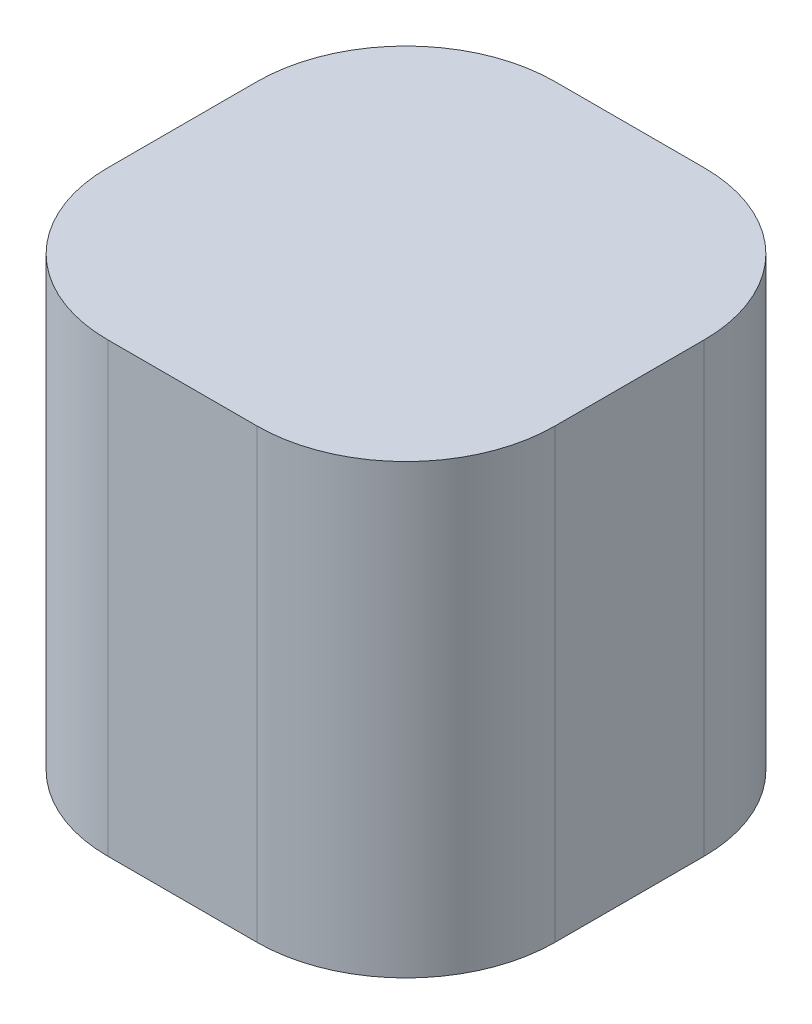
from build123d import *

# Parameters (mm, degrees)
SKETCH1_W           = 6
SKETCH1_H           = 6
BOSS_EXTRUDE1_DEPTH = 6
SKETCH2_W           = 2
SKETCH2_H           = 2
CUT_EXTRUDE1_DEPTH  = 2.5
FILLET1_R           = 2
CHAMFER1_SIZE       = 0.3
CHAMFER1_SIZE2      = 0.519615242


with BuildPart() as part:
    # Sketch1 → Boss-Extrude1 (new body)
    with BuildSketch(Plane(origin=(0, 0, 0), x_dir=(1, 0, 0), z_dir=(0, 1, 0))):
        Rectangle(SKETCH1_W, SKETCH1_H)
    extrude(amount=BOSS_EXTRUDE1_DEPTH)

    # Sketch2 → Cut-Extrude1 (cut)
    with BuildSketch(Plane.XZ):
        Rectangle(SKETCH2_W, SKETCH2_H)
    extrude(amount=-CUT_EXTRUDE1_DEPTH, mode=Mode.SUBTRACT)

    # Fillet1
    fillet1_edges = [part.edges().sort_by_distance(p)[0] for p in [
        (-3, 3, -3),
        (3, 3, -3),
        (3, 3, 3),
        (-3, 3, 3),
    ]]
    fillet(fillet1_edges, radius=FILLET1_R)

    # Chamfer1
    chamfer1_edges = [part.edges().sort_by_distance(p)[0] for p in [
        (-1, 0, 0),
        (0, 0, -1),
        (1, 0, 0),
        (0, 0, 1),
    ]]
    chamfer1_side = [part.faces().sort_by_distance(p)[0] for p in [
        (0, 0, 2.915147186),
    ]]
    chamfer(chamfer1_edges, length=CHAMFER1_SIZE, length2=CHAMFER1_SIZE2, reference=chamfer1_side[0])


solid = part.part
